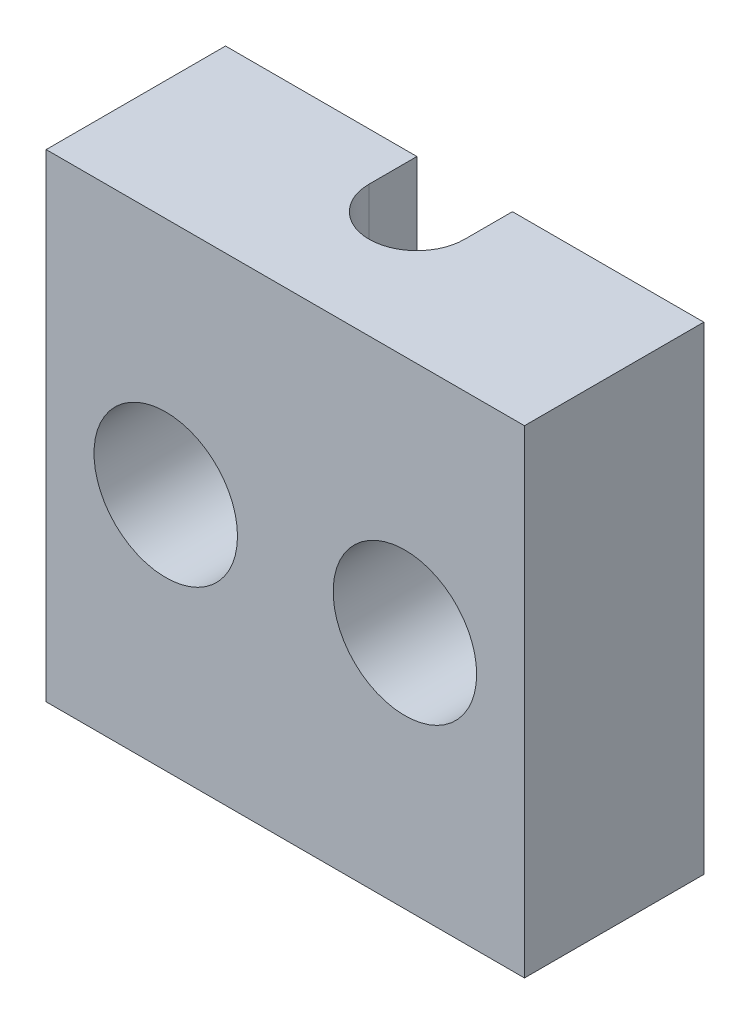
from build123d import *

# Parameters (mm, degrees)
SKETCH1_W           = 10.16
SKETCH1_H           = 10.16
BOSS_EXTRUDE1_DEPTH = 3.81
SKETCH2_R           = 1.524
CUT_EXTRUDE1_DEPTH  = 3.81
SKETCH3_R           = 1.01473
CUT_EXTRUDE3_DEPTH  = 10.16


with BuildPart() as part:
    # Sketch1 → Boss-Extrude1 (new body)
    with BuildSketch(Plane.XY):
        Rectangle(SKETCH1_W, SKETCH1_H)
    extrude(amount=BOSS_EXTRUDE1_DEPTH)

    # Sketch2 → Cut-Extrude1 (cut)
    with BuildSketch(Plane.XY.offset(3.81)):
        with Locations((2.54, 0)):
            Circle(SKETCH2_R)
        with Locations((-2.54, 0)):
            Circle(SKETCH2_R)
    extrude(amount=-CUT_EXTRUDE1_DEPTH, mode=Mode.SUBTRACT)

    # Sketch3 → Cut-Extrude3 (cut)
    with BuildSketch(Plane.XZ.offset(5.08)):
        with Locations((0, 1.016)):
            Circle(SKETCH3_R)
        with BuildLine():
            ThreePointArc((1.01473, 1.016), (0, 0.00127), (-1.01473, 1.016))
            Line((-1.01473, 1.016), (-1.01473, 0))
            Line((-1.01473, 0), (1.01473, 0))
            Line((1.01473, 0), (1.01473, 1.016))
        make_face()
    extrude(amount=-CUT_EXTRUDE3_DEPTH, mode=Mode.SUBTRACT)


solid = part.part
